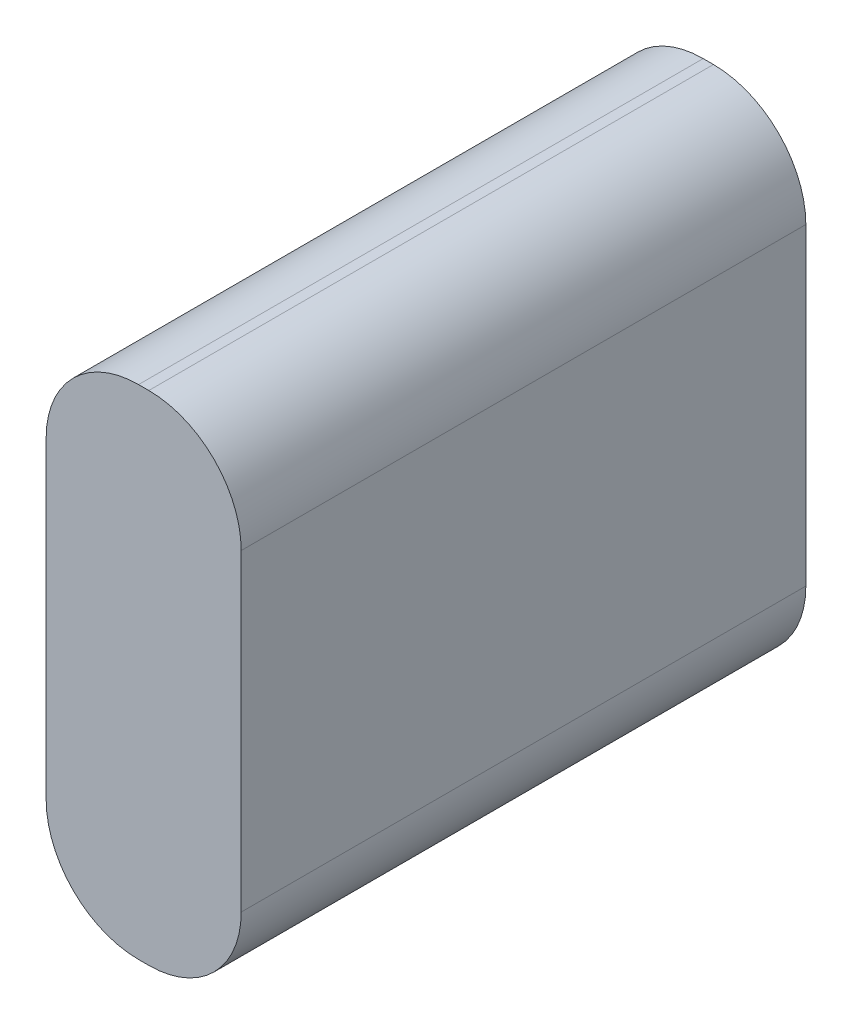
from build123d import *

# Parameters (mm, degrees)
SKETCH3_W           = 38
SKETCH3_H           = 97
BOSS_EXTRUDE1_DEPTH = 110
FILLET2_R           = 18


with BuildPart() as part:
    # Sketch3 → Boss-Extrude1 (new body)
    with BuildSketch(Plane.XY):
        with Locations((-6.669397001, -2.780009962)):
            Rectangle(SKETCH3_W, SKETCH3_H)
    extrude(amount=BOSS_EXTRUDE1_DEPTH)

    # Fillet2
    fillet2_edges = [part.edges().sort_by_distance(p)[0] for p in [
        (-25.669397001, 45.719990038, 55),
        (12.330602999, 45.719990038, 55),
        (12.330602999, -51.280009962, 55),
        (-25.669397001, -51.280009962, 55),
    ]]
    fillet(fillet2_edges, radius=FILLET2_R)


solid = part.part
